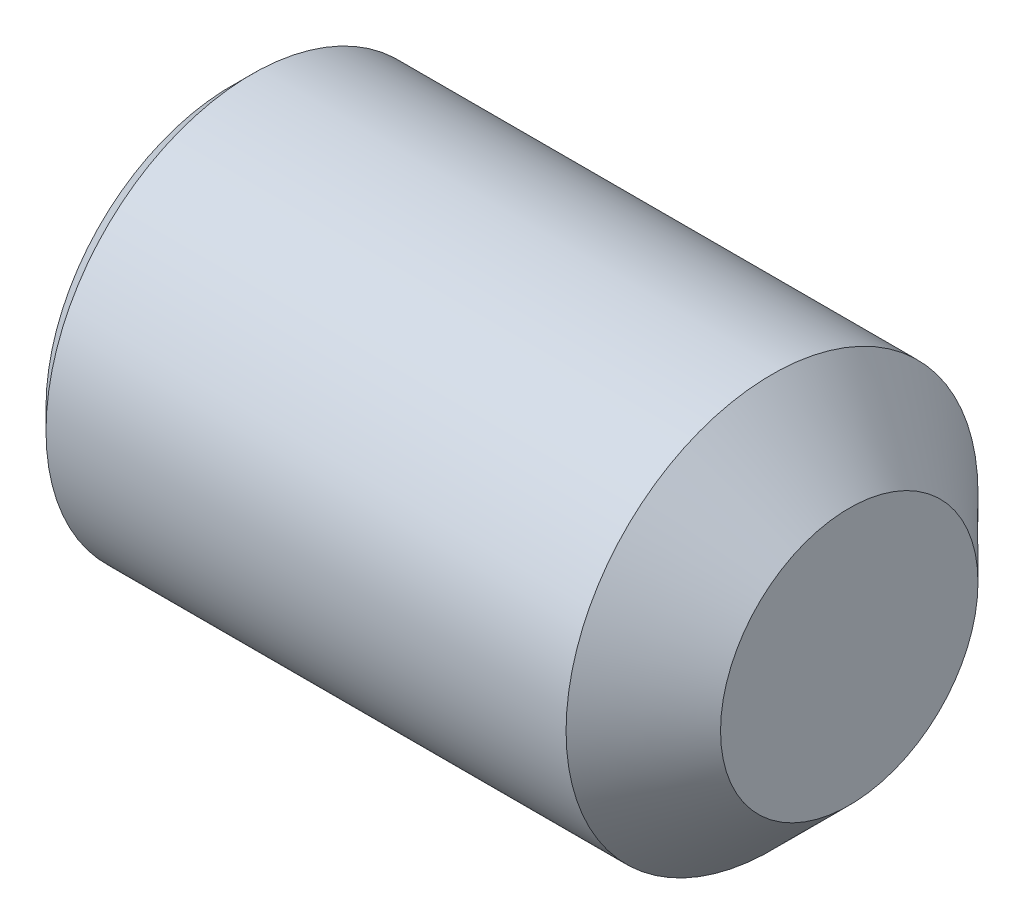
from build123d import *

# Parameters (mm, degrees)
SKETCH1_W          = 6
SKETCH1_H          = 2
CUT_EXTRUDE1_DEPTH = 2.3
CHAMFER1_SIZE      = 0.75
CHAMFER2_SIZE      = 0.2


with BuildPart() as part:
    # Sketch1 → Revolve1 (revolve)
    with BuildSketch(Plane(origin=(0, 0, 0), x_dir=(-1, 0, 0), z_dir=(0, 0, -1)), mode=Mode.PRIVATE) as revolve1_sk:
        with Locations((-3, 1)):
            Rectangle(SKETCH1_W, SKETCH1_H)
    revolve(revolve1_sk.sketch.rotate(Axis((6, 0, 0), (-1, 0, 0)), 270), axis=Axis((6, 0, 0), (-1, 0, 0)))

    # Sketch2 → Cut-Extrude1 (cut)
    with BuildSketch(Plane.ZY):
        Polygon((0.577350269, -1), (1.154700538, 0), (0.577350269, 1), (-0.577350269, 1), (-1.154700538, 0), (-0.577350269, -1), align=None)
    extrude(amount=-CUT_EXTRUDE1_DEPTH, mode=Mode.SUBTRACT)

    # Chamfer1
    chamfer1_edges = [part.edges().sort_by_distance(p)[0] for p in [
        (6, 0, -2),
    ]]
    chamfer(chamfer1_edges, length=CHAMFER1_SIZE)

    # Chamfer2
    chamfer2_edges = [part.edges().sort_by_distance(p)[0] for p in [
        (0, 0, -2),
    ]]
    chamfer(chamfer2_edges, length=CHAMFER2_SIZE)


solid = part.part
